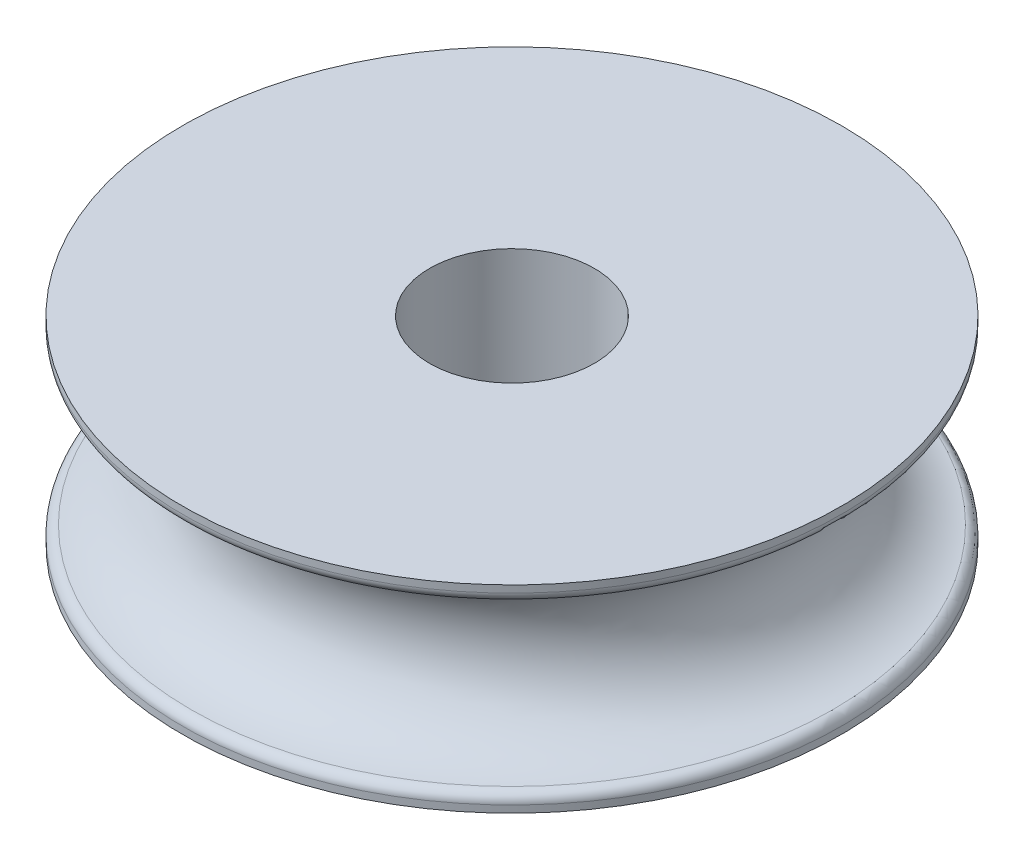
from build123d import *

# Parameters (mm, degrees)
SKETCH3_R          = 2.5
CUT_EXTRUDE1_DEPTH = 10


with BuildPart() as part:
    # Sketch2 → Revolve1 (revolve)
    with BuildSketch(Plane.XY, mode=Mode.PRIVATE) as revolve1_sk:
        with BuildLine():
            Line((0, 0), (10, 0))
            Line((10, 0), (10, 0.216117819))
            ThreePointArc((10, 0.216117819), (9.923207143, 0.41656375), (9.732142857, 0.514390909))
            ThreePointArc((9.732142857, 0.514390909), (7.5, 3), (9.732142857, 5.485609091))
            ThreePointArc((9.732142857, 5.485609091), (9.923207143, 5.58343625), (10, 5.783882181))
            Line((10, 5.783882181), (10, 6))
            Line((10, 6), (0, 6))
            Line((0, 6), (0, 0))
        make_face()
    revolve(revolve1_sk.sketch.rotate(Axis((0, 0, 0), (0, 1, 0)), 90), axis=Axis((0, 0, 0), (0, 1, 0)))

    # Sketch3 → Cut-Extrude1 (cut)
    with BuildSketch(Plane(origin=(0, 6, 0), x_dir=(1, 0, 0), z_dir=(0, 1, 0))):
        with Locations(Location((0, 0, 0), (0, 0, 270))):
            Circle(SKETCH3_R)
    extrude(amount=-CUT_EXTRUDE1_DEPTH, mode=Mode.SUBTRACT)


solid = part.part
